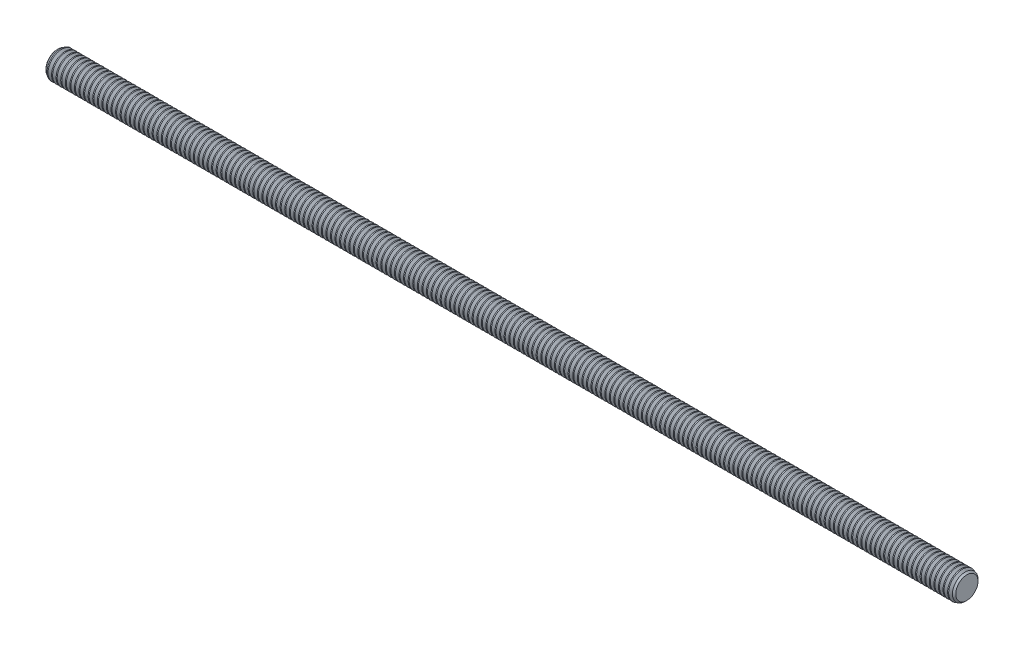
from build123d import *

# Parameters (mm, degrees)
BODYSKE_W       = 200
BODYSKE_H       = 3
CHAMFER1_SIZE   = 0.5545
THDSCHPAT_COUNT = 199
THDSCHPAT_PITCH = 1.005025126


with BuildPart() as part:
    # BodySke → BaseBody (revolve)
    with BuildSketch(Plane.XY, mode=Mode.PRIVATE) as basebody_sk:
        with Locations((100, 1.5)):
            Rectangle(BODYSKE_W, BODYSKE_H)
    revolve(basebody_sk.sketch.rotate(Axis((-3.175, 0, 0), (1, 0, 0)), 90), axis=Axis((-3.175, 0, 0), (1, 0, 0)))

    # Chamfer1
    chamfer1_edges = [part.edges().sort_by_distance(p)[0] for p in [
        (200, 0, -3),
        (0, 0, -3),
    ]]
    chamfer(chamfer1_edges, length=CHAMFER1_SIZE)

    # ThdSchSke → ThreadSchematic (revolve, cut)
    with BuildSketch(Plane.XY):
        Polygon((0.38826508, -2.4455), (0, -3), (0, -3.75), (0.77653016, -3.75), (0.77653016, -3), align=None)
    threadschematic = revolve(axis=Axis((-3.175, 0, 0), (1, 0, 0)), mode=Mode.SUBTRACT)

    # ThdSchPat: ThreadSchematic ×199
    with Locations(*[(i * THDSCHPAT_PITCH, 0, 0) for i in range(1, THDSCHPAT_COUNT)]):
        add(threadschematic, mode=Mode.SUBTRACT)


solid = part.part
